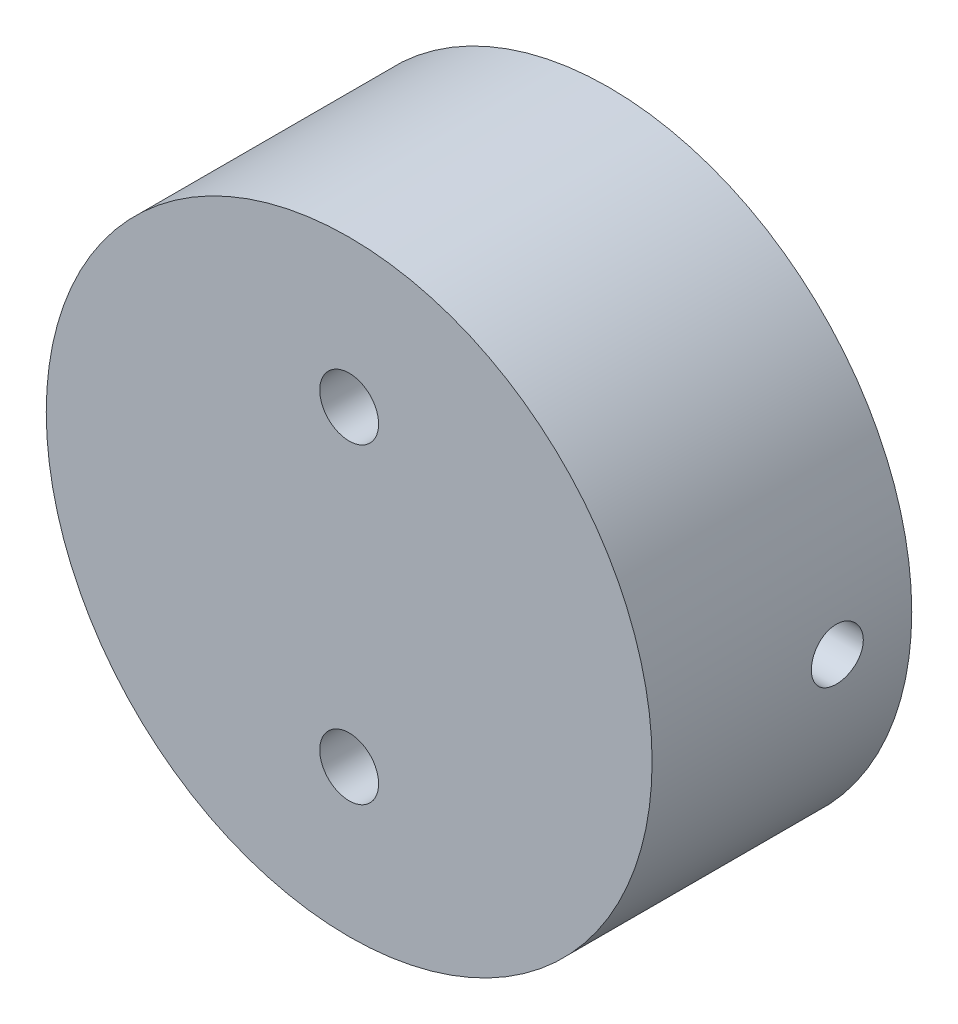
from build123d import *

# Parameters (mm, degrees)
SKETCH1_R                           = 17.5
SKETCH1_R_2                         = 2.5
BOSS_EXTRUDE1_DEPTH                 = 10
BOSS_EXTRUDE2_START                 = 5
SKETCH1_3_R                         = 17.5
BOSS_EXTRUDE2_DEPTH                 = 5
M3_CLEARANCE_HOLE1_D                = 3.4
CUT_EXTRUDE1_REACH                  = 32.582
CUT_EXTRUDE1_END_RADIUS             = 17.5
SKETCH8_R                           = 1.5
CUT_EXTRUDE1_DIRECTION_2_REACH      = 32.582
CUT_EXTRUDE1_DIRECTION_2_END_RADIUS = 2.5
CUT_EXTRUDE2_DEPTH                  = 2.2


with BuildPart() as part:
    # Sketch1 → Boss-Extrude1 (new body)
    with BuildSketch(Plane.XY):
        Circle(SKETCH1_R)
        Circle(SKETCH1_R_2, mode=Mode.SUBTRACT)
        Polygon((1.58771324, 11.75), (-1.58771324, 11.75), (-3.175426481, 9), (-1.58771324, 6.25), (1.58771324, 6.25), (3.175426481, 9), align=None, mode=Mode.SUBTRACT)
        Polygon((1.58771324, -6.25), (-1.58771324, -6.25), (-3.175426481, -9), (-1.58771324, -11.75), (1.58771324, -11.75), (3.175426481, -9), align=None, mode=Mode.SUBTRACT)
    extrude(amount=-BOSS_EXTRUDE1_DEPTH)

    # Sketch1<3> → Boss-Extrude2 (add)
    with BuildSketch(Plane.XY.offset(BOSS_EXTRUDE2_START)):
        Circle(SKETCH1_3_R)
    extrude(amount=-BOSS_EXTRUDE2_DEPTH)

    # M3 Clearance Hole1 (through all)
    with Locations(Plane.XY.offset(5)):
        with Locations((0, 9), (0, -9)):
            Hole(M3_CLEARANCE_HOLE1_D / 2)

    # Cut-Extrude1: up to this cylinder (the profile starts inside it)
    cut_extrude1_end = Plane(origin=(0, 0, -5.7), z_dir=(0, 0, 1)) * Cylinder(CUT_EXTRUDE1_END_RADIUS, 101.164, mode=Mode.PRIVATE)
    # Sketch8 → Cut-Extrude1 (cut, up to the surface)
    with BuildSketch(Plane(origin=(5.5, 0, 0), x_dir=(0, 0, -1), z_dir=(1, 0, 0)), mode=Mode.PRIVATE) as cut_extrude1_sk1:
        with Locations((5.7, 0)):
            Circle(SKETCH8_R)
    cut_extrude1_tool1 = extrude(cut_extrude1_sk1.sketch, amount=CUT_EXTRUDE1_REACH, mode=Mode.PRIVATE) & cut_extrude1_end
    cut_extrude1 = cut_extrude1_tool1.solids().sort_by_distance((5.5, 0, -5.7))[0]
    add(cut_extrude1, mode=Mode.SUBTRACT)

    # Cut-Extrude1 direction 2: up to this cylinder (the profile starts outside it)
    cut_extrude1_direction_2_end = Plane(origin=(0, 0, -5.7), z_dir=(0, 0, 1)) * Cylinder(CUT_EXTRUDE1_DIRECTION_2_END_RADIUS, 71.164, mode=Mode.PRIVATE)
    # Sketch8 → Cut-Extrude1 direction 2 (cut, up to the surface)
    with BuildSketch(Plane(origin=(5.5, 0, 0), x_dir=(0, 0, -1), z_dir=(1, 0, 0)), mode=Mode.PRIVATE) as cut_extrude1_direction_2_sk1:
        with Locations((5.7, 0)):
            Circle(SKETCH8_R)
    cut_extrude1_direction_2_tool1 = extrude(cut_extrude1_direction_2_sk1.sketch, amount=-CUT_EXTRUDE1_DIRECTION_2_REACH, mode=Mode.PRIVATE) - cut_extrude1_direction_2_end
    cut_extrude1_direction_2 = cut_extrude1_direction_2_tool1.solids().sort_by_distance((5.5, 0, -5.7))[0]
    add(cut_extrude1_direction_2, mode=Mode.SUBTRACT)
    cut_extrude1 = cut_extrude1 + cut_extrude1_direction_2  # both directions under the feature's name, for the pattern or mirror that repeats it

    # Sketch8<4> → Cut-Extrude2 (cut)
    with BuildSketch(Plane(origin=(5.5, 0, 0), x_dir=(0, 0, -1), z_dir=(1, 0, 0))):
        Polygon((8.5, 2.8), (2.9, 2.8), (2.9, -2.8), (8.5, -2.8), (10, -2.8), (10, 2.8), align=None)
    cut_extrude2 = extrude(amount=CUT_EXTRUDE2_DEPTH, mode=Mode.SUBTRACT)

    # Mirror1: Cut-Extrude1, Cut-Extrude2 across plane
    add(cut_extrude1.mirror(Plane(origin=(0, 0, 0), x_dir=(0, 0, 1), z_dir=(1, 0, 0))), mode=Mode.SUBTRACT)
    add(cut_extrude2.mirror(Plane(origin=(0, 0, 0), x_dir=(0, 0, 1), z_dir=(1, 0, 0))), mode=Mode.SUBTRACT)


solid = part.part
